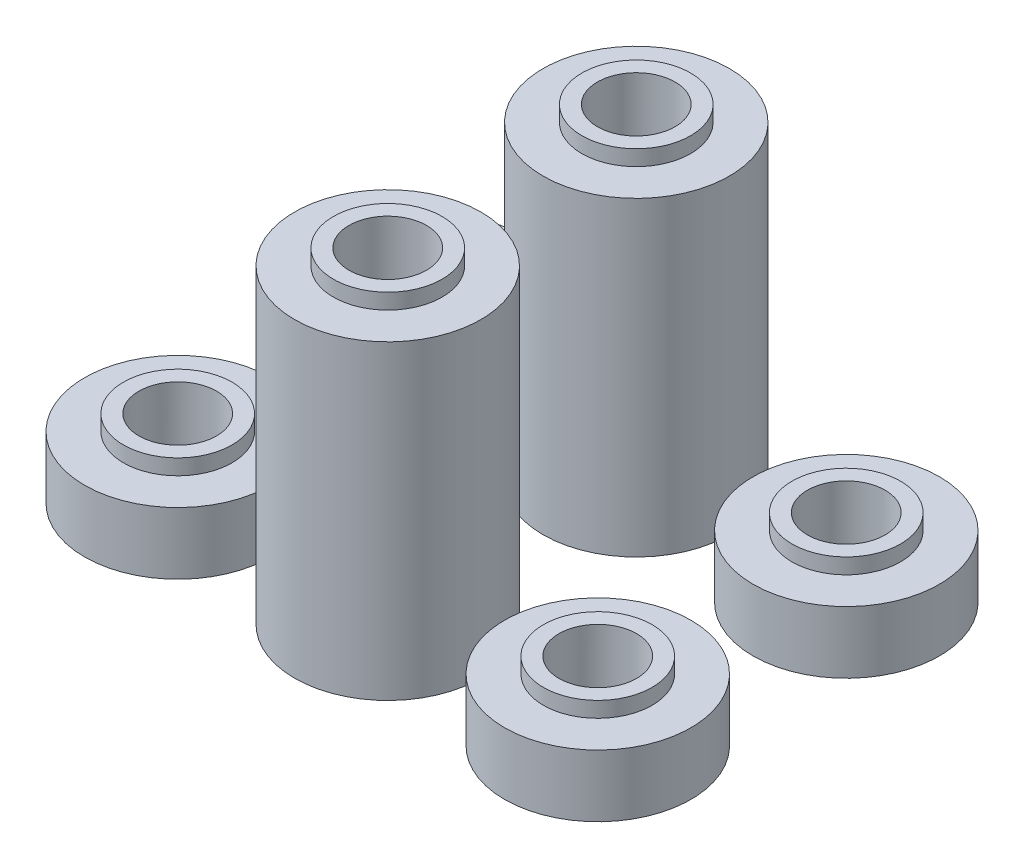
from build123d import *

# Parameters (mm, degrees)
CROQUIS1_R              = 6
SALIENTE_EXTRUIR1_DEPTH = 20
CROQUIS2_R              = 2.5
CORTAR_EXTRUIR1_DEPTH   = 20
SALIENTE_EXTRUIR2_START = 1
CROQUIS3_R              = 3.5
CROQUIS3_R_2            = 2.5
SALIENTE_EXTRUIR2_DEPTH = 1
CROQUIS4_R              = 4.5
CORTAR_EXTRUIR2_DEPTH   = 5
CROQUIS5_R              = 6
SALIENTE_EXTRUIR3_DEPTH = 4
CROQUIS6_R              = 2.5
CORTAR_EXTRUIR3_DEPTH   = 4
CROQUIS7_R              = 3.5
CROQUIS7_R_2            = 2.5
SALIENTE_EXTRUIR4_DEPTH = 1
CROQUIS8_R              = 3.5
CROQUIS8_R_2            = 2.5
CORTAR_EXTRUIR4_DEPTH   = 1


with BuildPart() as part:
    # Croquis1 → Saliente-Extruir1 (new body)
    with BuildSketch(Plane(origin=(0, 0, 0), x_dir=(1, 0, 0), z_dir=(0, 1, 0))):
        with Locations(Location((0, 0, 0), (0, 0, 270))):
            Circle(CROQUIS1_R)
    extrude(amount=SALIENTE_EXTRUIR1_DEPTH)

    # Croquis2 → Cortar-Extruir1 (cut)
    with BuildSketch(Plane(origin=(0, 20, 0), x_dir=(1, 0, 0), z_dir=(0, 1, 0))):
        with Locations(Location((0, 0, 0), (0, 0, 270))):
            Circle(CROQUIS2_R)
    extrude(amount=-CORTAR_EXTRUIR1_DEPTH, mode=Mode.SUBTRACT)

    # Croquis3 → Saliente-Extruir2 (add)
    with BuildSketch(Plane(origin=(0, 20, 0), x_dir=(1, 0, 0), z_dir=(0, 1, 0)).offset(SALIENTE_EXTRUIR2_START)):
        with Locations(Location((0, 0, 0), (0, 0, 270))):
            Circle(CROQUIS3_R)
        with Locations(Location((0, 0, 0), (0, 0, 270))):
            Circle(CROQUIS3_R_2, mode=Mode.SUBTRACT)
    extrude(amount=-SALIENTE_EXTRUIR2_DEPTH)

    # Croquis4 → Cortar-Extruir2 (cut)
    with BuildSketch(Plane.XZ):
        with Locations(Location((0, 0, 0), (0, 0, 270))):
            Circle(CROQUIS4_R)
    extrude(amount=-CORTAR_EXTRUIR2_DEPTH, mode=Mode.SUBTRACT)


with BuildPart() as body_2:
    # Croquis5 → Saliente-Extruir3 (new body)
    with BuildSketch(Plane(origin=(0, 0, 0), x_dir=(1, 0, 0), z_dir=(0, 1, 0))):
        with Locations(Location((-13.521991575, 0, 0), (0, 0, 270))):
            Circle(CROQUIS5_R)
    extrude(amount=SALIENTE_EXTRUIR3_DEPTH)

    # Croquis6 → Cortar-Extruir3 (cut)
    with BuildSketch(Plane(origin=(0, 4, 0), x_dir=(1, 0, 0), z_dir=(0, 1, 0))):
        with Locations(Location((-13.521991575, 0, 0), (0, 0, 270))):
            Circle(CROQUIS6_R)
    extrude(amount=-CORTAR_EXTRUIR3_DEPTH, mode=Mode.SUBTRACT)

    # Croquis7 → Saliente-Extruir4 (add)
    with BuildSketch(Plane(origin=(0, 4, 0), x_dir=(1, 0, 0), z_dir=(0, 1, 0))):
        with Locations(Location((-13.521991575, 0, 0), (0, 0, 270))):
            Circle(CROQUIS7_R)
        with Locations(Location((-13.521991575, 0, 0), (0, 0, 270))):
            Circle(CROQUIS7_R_2, mode=Mode.SUBTRACT)
    extrude(amount=SALIENTE_EXTRUIR4_DEPTH)

    # Croquis8 → Cortar-Extruir4 (cut)
    with BuildSketch(Plane.XZ):
        with Locations(Location((-13.521991575, 0, 0), (0, 0, 90))):
            Circle(CROQUIS8_R)
        with Locations(Location((-13.521991575, 0, 0), (0, 0, 90))):
            Circle(CROQUIS8_R_2, mode=Mode.SUBTRACT)
    extrude(amount=-CORTAR_EXTRUIR4_DEPTH, mode=Mode.SUBTRACT)


with BuildPart() as body_3:
    # Simetría2: mirrored copy
    add(body_2.part.mirror(Plane(origin=(0, 0, 0), x_dir=(0, 0, 1), z_dir=(1, 0, 0))))


with BuildPart() as body_4:
    # Simetría3: mirrored copy
    add(body_3.part.mirror(Plane.XY.offset(8)))


with BuildPart() as body_5:
    # Simetr_a3 2: mirrored copy
    add(part.part.mirror(Plane.XY.offset(8)))


with BuildPart() as body_6:
    # Simetr_a3 3: mirrored copy
    add(body_2.part.mirror(Plane.XY.offset(8)))


solid = Compound([part.part, body_2.part, body_3.part, body_4.part, body_5.part, body_6.part])
